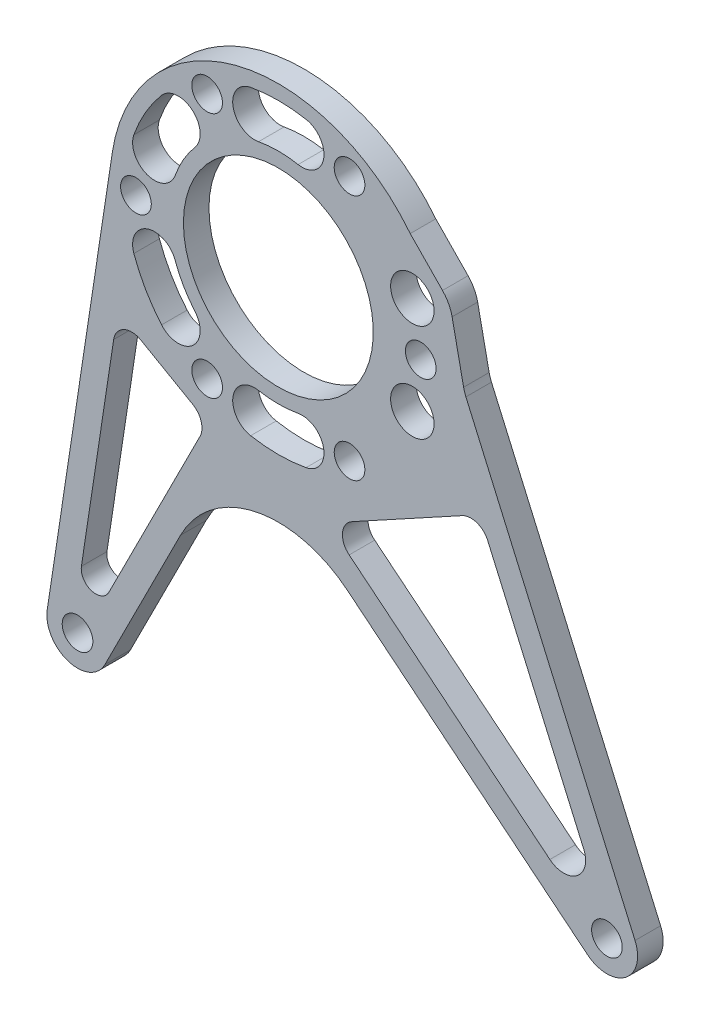
from build123d import *

# Parameters (mm, degrees)
BOSS_EXTRUDE1_DEPTH = 3.5
BOSS_EXTRUDE4_DEPTH = 7
SKETCH3_R           = 26
SKETCH3_R_2         = 4.2
SKETCH3_R_3         = 5.95
CUT_EXTRUDE1_DEPTH  = 156.479666598
CUT_EXTRUDE3_DEPTH  = 156.479666598
CUT_EXTRUDE5_DEPTH  = 156.479666598
CUT_EXTRUDE6_DEPTH  = 156.479666598
CIRPATTERN1_COUNT   = 6


with BuildPart() as part:
    # Sketch2 → Boss-Extrude1 (new, symmetric)
    with BuildSketch(Plane.XY):
        with BuildLine():
            Line((-45.478900867, 6.904315749), (-63.304842767, -110.515610278))
            ThreePointArc((-63.304842767, -110.515610278), (-57.554578813, -119.77853103), (-47.500804036, -115.560848118))
            Line((-47.500804036, -115.560848118), (-26.78284273, -74.506517319))
            ThreePointArc((-26.78284273, -74.506517319), (-6.255979799, -58.681947165), (18.940409864, -64.757395322))
            Line((18.940409864, -64.757395322), (84.696685238, -118.290602278))
            ThreePointArc((84.696685238, -118.290602278), (95.084548335, -118.462755244), (97.694455028, -108.406626595))
            Line((97.694455028, -108.406626595), (42.136301343, 18.453512109))
            ThreePointArc((42.136301343, 18.453512109), (-6.011591057, 45.605490601), (-45.478900867, 6.904315749))
        make_face()
    extrude(amount=BOSS_EXTRUDE1_DEPTH, both=True)

    # Sketch4 → Boss-Extrude4 (add, through all)
    with BuildSketch(Plane.XY.offset(3.5)):
        with BuildLine():
            Line((29.393386496, 35.38401942), (44.963587603, 19.409766638))
            ThreePointArc((44.963587603, 19.409766638), (46.631084985, 17.126299569), (47.592760093, 14.467361743))
            Line((47.592760093, 14.467361743), (50.74066814, -0.658267229))
            ThreePointArc((50.74066814, -0.658267229), (51.004474494, -1.661692304), (51.370828532, -2.632382983))
            Line((51.370828532, -2.632382983), (97.694455028, -108.406626595))
            ThreePointArc((97.694455028, -108.406626595), (95.084548335, -118.462755244), (84.696685238, -118.290602278))
            Line((84.696685238, -118.290602278), (18.940409864, -64.757395322))
            ThreePointArc((18.940409864, -64.757395322), (-6.255979799, -58.681947165), (-26.78284273, -74.506517319))
            Line((-26.78284273, -74.506517319), (-47.500804036, -115.560848118))
            ThreePointArc((-47.500804036, -115.560848118), (-57.554578813, -119.77853103), (-63.304842767, -110.515610278))
            Line((-63.304842767, -110.515610278), (-45.478900867, 6.904315749))
            ThreePointArc((-45.478900867, 6.904315749), (-16.354183668, 42.994658698), (29.393386496, 35.38401942))
        make_face()
    extrude(amount=-BOSS_EXTRUDE4_DEPTH)

    # Sketch3 → Cut-Extrude1 (cut, through all)
    with BuildSketch(Plane(origin=(0, 0, -3.5), x_dir=(-1, 0, 0), z_dir=(0, 0, -1))):
        Circle(SKETCH3_R)
        with Locations((19.5, 33.774990748)):
            Circle(SKETCH3_R_2)
        with Locations((-19.5, 33.774990748)):
            Circle(SKETCH3_R_2)
        with Locations((-36.7, 13.4)):
            Circle(SKETCH3_R_3)
        with Locations((-39, 0)):
            Circle(SKETCH3_R_2)
        with Locations((-36.7, -13.4)):
            Circle(SKETCH3_R_3)
        with Locations((-19.5, -33.774990748)):
            Circle(SKETCH3_R_2)
        with Locations((19.5, -33.774990748)):
            Circle(SKETCH3_R_2)
        with Locations((39, 0)):
            Circle(SKETCH3_R_2)
        with Locations((-90, -111.776398371)):
            Circle(SKETCH3_R_2)
        with Locations((55, -111.776398371)):
            Circle(SKETCH3_R_2)
    extrude(amount=-CUT_EXTRUDE1_DEPTH, mode=Mode.SUBTRACT)

    # Sketch5 → Cut-Extrude3 (cut, through all)
    with BuildSketch(Plane(origin=(0, 0, -3.5), x_dir=(-1, 0, 0), z_dir=(0, 0, -1))):
        with BuildLine():
            Line((-50.350110091, -31.309459743), (-20.150300754, -47.836521791))
            ThreePointArc((-20.150300754, -47.836521791), (-17.571466955, -51.766920177), (-19.393917714, -56.100173974))
            Line((-19.393917714, -56.100173974), (-74.370376325, -100.857364368))
            ThreePointArc((-74.370376325, -100.857364368), (-81.790278537, -100.980330772), (-83.654497603, -93.797381737))
            Line((-83.654497603, -93.797381737), (-57.330494783, -33.689793067))
            ThreePointArc((-57.330494783, -33.689793067), (-54.364230538, -30.963194657), (-50.350110091, -31.309459743))
        make_face()
    extrude(amount=-CUT_EXTRUDE3_DEPTH, mode=Mode.SUBTRACT)

    # Sketch7 → Cut-Extrude5 (cut, through all)
    with BuildSketch(Plane(origin=(0, 0, -3.5), x_dir=(-1, 0, 0), z_dir=(0, 0, -1))):
        with BuildLine():
            Line((23.433420065, -41.81343059), (37.676807322, -33.666002693))
            ThreePointArc((37.676807322, -33.666002693), (42.335474705, -33.504479598), (45.102778478, -37.255652924))
            Line((45.102778478, -37.255652924), (53.940298501, -95.468618789))
            ThreePointArc((53.940298501, -95.468618789), (51.202077571, -99.879533433), (46.414565772, -97.871112999))
            Line((46.414565772, -97.871112999), (21.45222531, -48.406198584))
            ThreePointArc((21.45222531, -48.406198584), (21.12757408, -44.71456882), (23.433420065, -41.81343059))
        make_face()
    extrude(amount=-CUT_EXTRUDE5_DEPTH, mode=Mode.SUBTRACT)

    # Sketch8 → Cut-Extrude6 (cut, through all)
    with BuildSketch(Plane(origin=(0, 0, -3.5), x_dir=(-1, 0, 0), z_dir=(0, 0, -1))):
        with BuildLine():
            ThreePointArc((7.583333333, 41.309721078), (0, 42), (-7.583333333, 41.309721078))
            ThreePointArc((-7.583333333, 41.309721078), (-12.401388725, 34.324999019), (-5.416666667, 29.506943627))
            ThreePointArc((-5.416666667, 29.506943627), (0, 30), (5.416666667, 29.506943627))
            ThreePointArc((5.416666667, 29.506943627), (12.401388725, 34.324999019), (7.583333333, 41.309721078))
        make_face()
    cut_extrude6 = extrude(amount=-CUT_EXTRUDE6_DEPTH, mode=Mode.SUBTRACT)

    # CirPattern1: Cut-Extrude6 ×6 about axis, 2 skipped
    cirpattern1_axis = Axis((0, 0, 37.050489462), (0, 0, -1))
    add([cut_extrude6.rotate(cirpattern1_axis, i * 360 / CIRPATTERN1_COUNT) for i in range(1, CIRPATTERN1_COUNT) if i not in (1, 2)], mode=Mode.SUBTRACT)


solid = part.part
